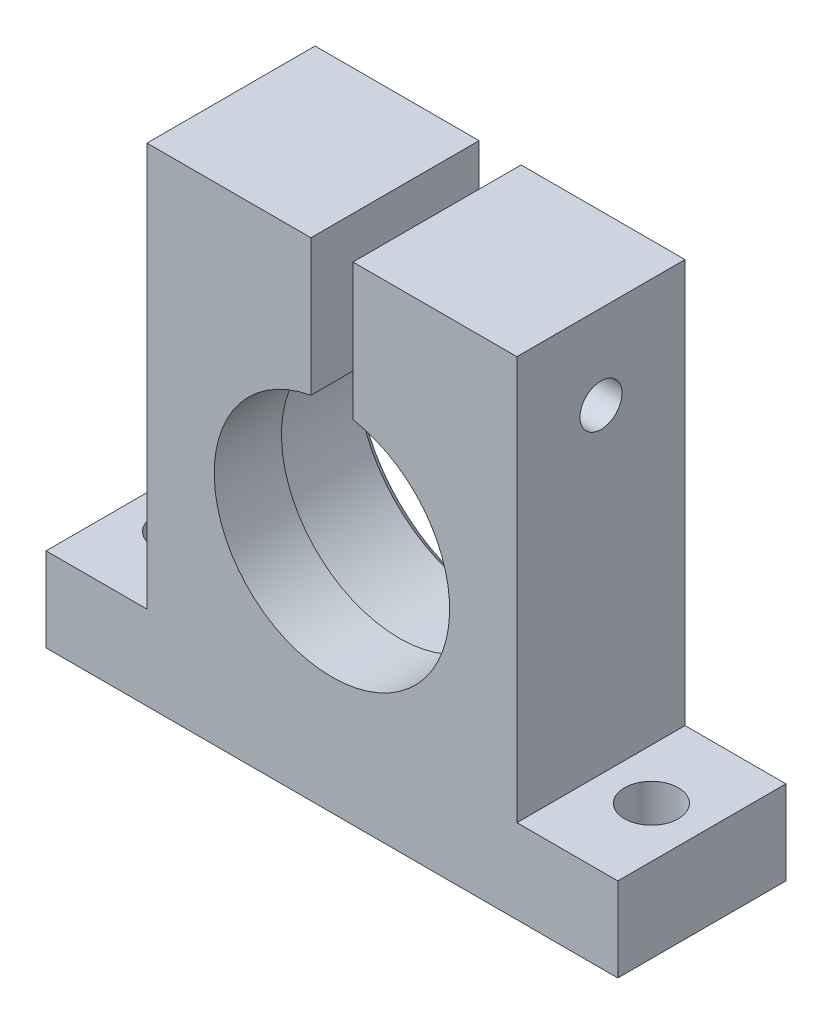
from build123d import *

# Parameters (mm, degrees)
SKETCH1_W                      = 22
SKETCH1_H                      = 29
BOSS_EXTRUDE1_DEPTH            = 5
SKETCH3_W                      = 34
SKETCH3_H                      = 10
BOSS_EXTRUDE2_DEPTH            = 5
F_16_0_16_DIAMETER_HOLE1_D     = 16
F_16_0_16_DIAMETER_HOLE1_DEPTH = 6
F_14_0_14_DIAMETER_HOLE1_D     = 14
M3_CLEARANCE_HOLE1_D           = 3.2
SKETCH12_W                     = 2.5
SKETCH12_H                     = 8.112511343
CUT_EXTRUDE1_DEPTH             = 25.779023387
CBORE_FOR_M3_SHCS1_D           = 3.2
CBORE_FOR_M3_SHCS1_DEPTH       = 9.75
CBORE_FOR_M3_SHCS1_CBORE_D     = 6.5
CBORE_FOR_M3_SHCS1_CBORE_DEPTH = 3
CHAMFER1_SIZE                  = 0.5
M3X0_5_TAPPED_HOLE1_D          = 2.5


with BuildPart() as part:
    # Sketch1 → Boss-Extrude1 (new, symmetric)
    with BuildSketch(Plane.XY):
        with Locations((0, 0.5)):
            Rectangle(SKETCH1_W, SKETCH1_H)
    extrude(amount=BOSS_EXTRUDE1_DEPTH, both=True)

    # Sketch3 → Boss-Extrude2 (add)
    with BuildSketch(Plane.XZ.offset(14)):
        Rectangle(SKETCH3_W, SKETCH3_H)
    extrude(amount=-BOSS_EXTRUDE2_DEPTH)

    # Ø16.0 (16) Diameter Hole1
    with Locations(Plane(origin=(0, 0, -5), x_dir=(-1, 0, 0), z_dir=(0, 0, -1))):
        with Locations((0, 0)):
            Hole(F_16_0_16_DIAMETER_HOLE1_D / 2, depth=F_16_0_16_DIAMETER_HOLE1_DEPTH)

    # Ø14.0 (14) Diameter Hole1 (through all)
    with Locations(Plane(origin=(0, 0, 1), x_dir=(-1, 0, 0), z_dir=(0, 0, -1))):
        with Locations((0, 0)):
            Hole(F_14_0_14_DIAMETER_HOLE1_D / 2)

    # M3 Clearance Hole1 (through all)
    with Locations(Plane(origin=(0, -9, 0), x_dir=(1, 0, 0), z_dir=(0, 1, 0))):
        with Locations((-14, 0), (14, 0)):
            Hole(M3_CLEARANCE_HOLE1_D / 2)

    # Sketch12 → Cut-Extrude1 (cut, through all)
    with BuildSketch(Plane.XY.offset(5)):
        with Locations((0, 10.943744329)):
            Rectangle(SKETCH12_W, SKETCH12_H)
    extrude(amount=-CUT_EXTRUDE1_DEPTH, mode=Mode.SUBTRACT)

    # CBORE for M3 SHCS1
    with Locations(Plane(origin=(11, 0, 0), x_dir=(0, 0, -1), z_dir=(1, 0, 0))):
        with Locations((0, 10)):
            CounterBoreHole(CBORE_FOR_M3_SHCS1_D / 2, CBORE_FOR_M3_SHCS1_CBORE_D / 2, CBORE_FOR_M3_SHCS1_CBORE_DEPTH, depth=CBORE_FOR_M3_SHCS1_DEPTH)

    # Chamfer1
    chamfer1_edges = [part.edges().sort_by_distance(p)[0] for p in [
        (0, -8, -5),
    ]]
    chamfer(chamfer1_edges, length=CHAMFER1_SIZE)


with BuildPart() as body_2:
    # Mirror1: mirrored copy
    add(part.part.mirror(Plane(origin=(-17, -9, -5), x_dir=(0, 0, 1), z_dir=(-1, 0, 0))))

    # M3x0.5 Tapped Hole1 (through all)
    with Locations(Plane(origin=(-23, 0, 0), x_dir=(0, 0, -1), z_dir=(1, 0, 0))):
        with Locations((0, 10)):
            Hole(M3X0_5_TAPPED_HOLE1_D / 2)


solid = body_2.part
